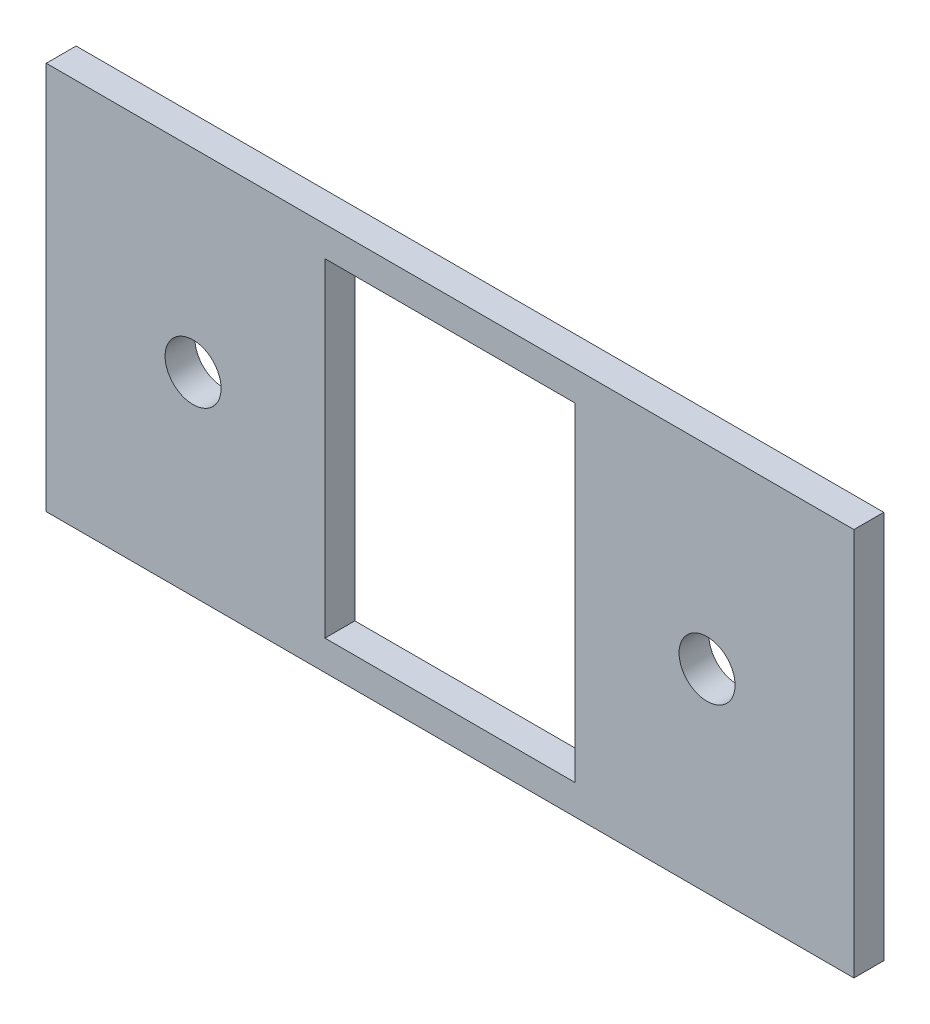
from build123d import *

# Parameters (mm, degrees)
SKETCH1_W           = 54.070507504
SKETCH1_H           = 26
SKETCH1_R           = 1.875
SKETCH1_W_2         = 16.75
SKETCH1_H_2         = 22
BOSS_EXTRUDE1_DEPTH = 2


with BuildPart() as part:
    # Sketch1 → Boss-Extrude1 (new body)
    with BuildSketch(Plane.XY):
        with Locations((0, 13)):
            Rectangle(SKETCH1_W, SKETCH1_H)
        with Locations(Location((17.205126876, 13, 0), (0, 0, 180))):
            Circle(SKETCH1_R, mode=Mode.SUBTRACT)
        with Locations((-17.205126876, 13)):
            Circle(SKETCH1_R, mode=Mode.SUBTRACT)
        with Locations((0, 13)):
            Rectangle(SKETCH1_W_2, SKETCH1_H_2, mode=Mode.SUBTRACT)
    extrude(amount=BOSS_EXTRUDE1_DEPTH)


solid = part.part
